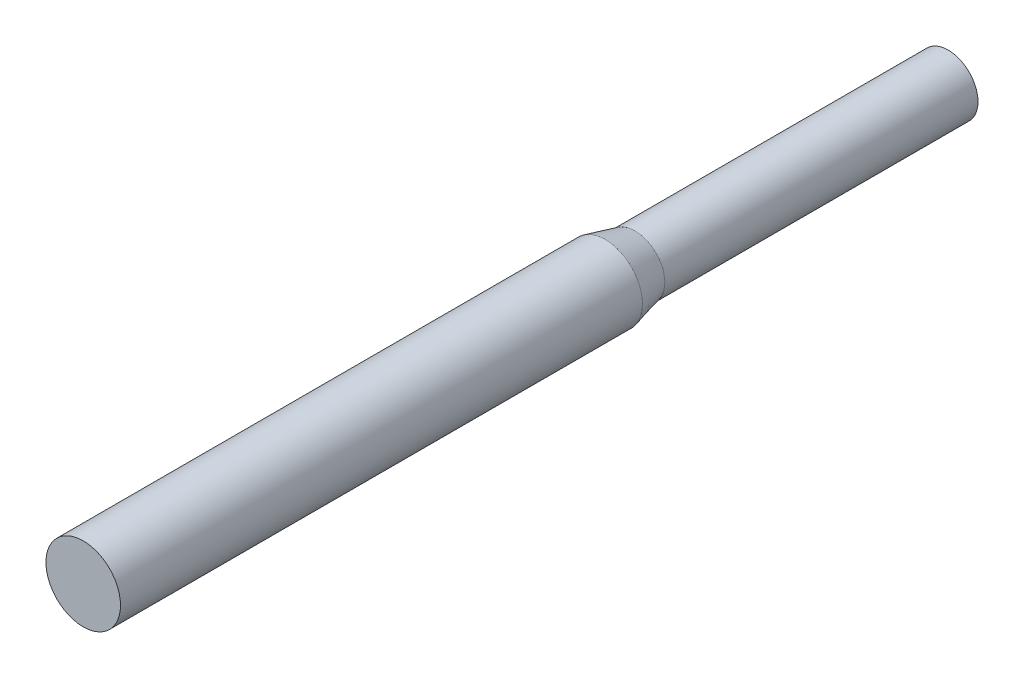
from build123d import *

# Parameters (mm, degrees)
SKETCH1_R           = 2
BOSS_EXTRUDE1_DEPTH = 23
SKETCH3_R           = 2.5
BOSS_EXTRUDE3_DEPTH = 35
CHAMFER1_SIZE       = 2
CHAMFER1_SIZE2      = 0.498656006


with BuildPart() as part:
    # Sketch1 → Boss-Extrude1 (new body)
    with BuildSketch(Plane.XY):
        Circle(SKETCH1_R)
    extrude(amount=BOSS_EXTRUDE1_DEPTH)

    # Sketch3 → Boss-Extrude3 (add)
    with BuildSketch(Plane.XY.offset(23)):
        Circle(SKETCH3_R)
    extrude(amount=BOSS_EXTRUDE3_DEPTH)

    # Chamfer1
    chamfer1_edges = [part.edges().sort_by_distance(p)[0] for p in [
        (-2, 0, 23),
    ]]
    chamfer1_side = [part.faces().sort_by_distance(p)[0] for p in [
        (-2, 0, 11.5),
    ]]
    chamfer(chamfer1_edges, length=CHAMFER1_SIZE, length2=CHAMFER1_SIZE2, reference=chamfer1_side[0])


solid = part.part
